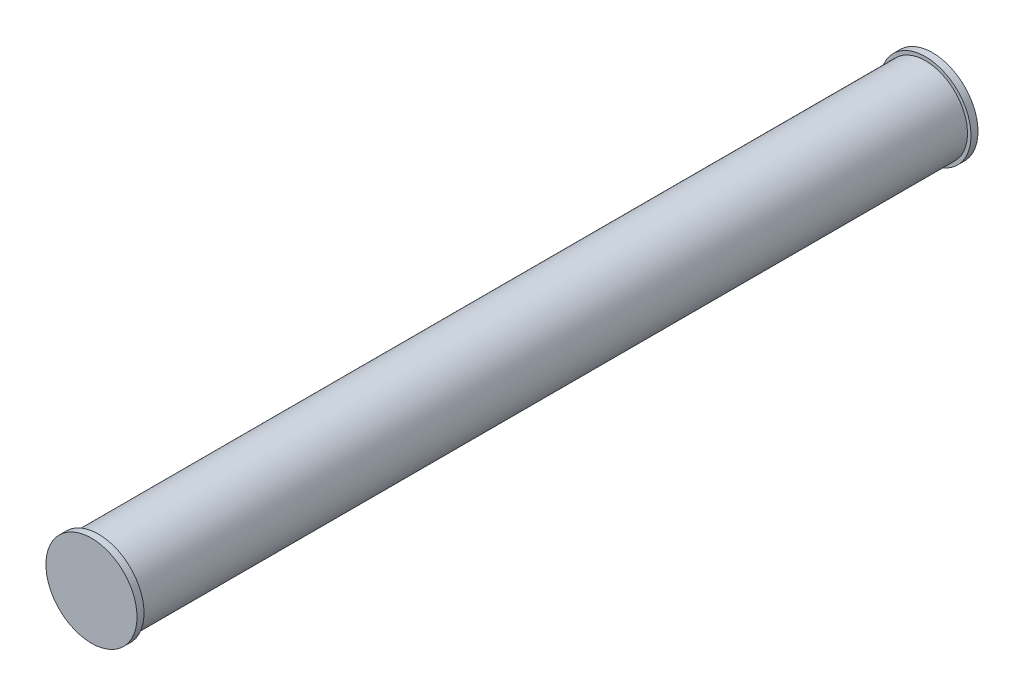
from build123d import *

# Parameters (mm, degrees)
SKETCH1_R           = 15.24
BOSS_EXTRUDE1_DEPTH = 152.4
SKETCH2_R           = 16.51
BOSS_EXTRUDE2_DEPTH = 2.54


with BuildPart() as part:
    # Sketch1 → Boss-Extrude1 (new, symmetric)
    with BuildSketch(Plane.XY):
        with Locations(Location((0, 0, 0), (0, 0, 180))):
            Circle(SKETCH1_R)
    extrude(amount=BOSS_EXTRUDE1_DEPTH, both=True)

    # Sketch2 → Boss-Extrude2 (add)
    with BuildSketch(Plane.XY.offset(152.4)):
        Circle(SKETCH2_R)
    boss_extrude2 = extrude(amount=-BOSS_EXTRUDE2_DEPTH)

    # Mirror1: Boss-Extrude2 across plane
    add(boss_extrude2.mirror(Plane.XY))


solid = part.part
